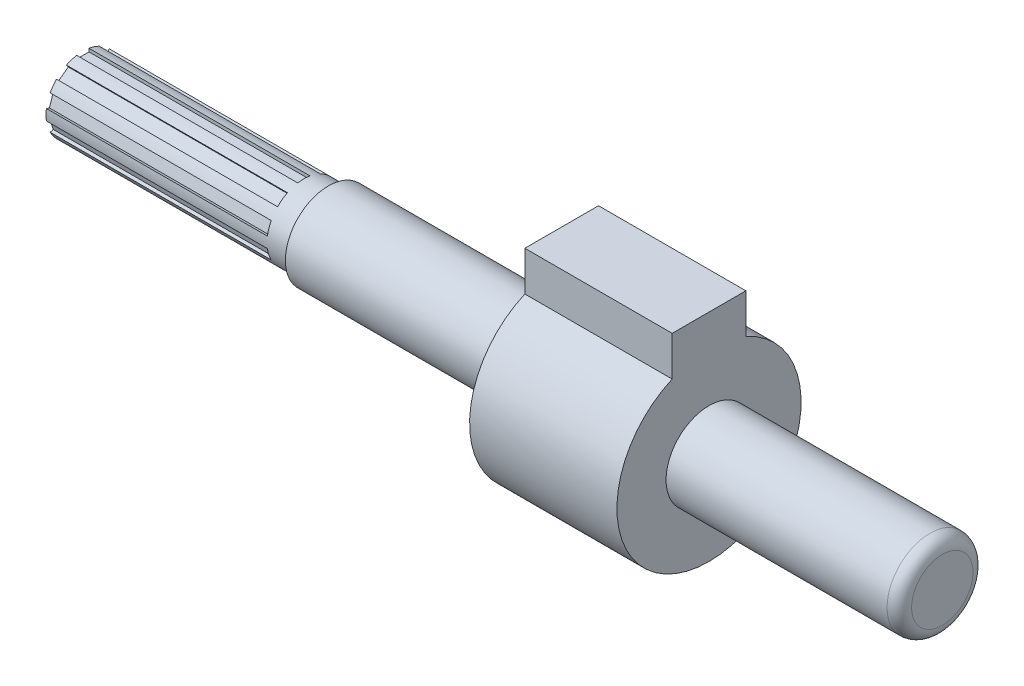
from build123d import *

# Parameters (mm, degrees)
Y_KSEKLIK_EKSTR_ZYON2_START = -12
Y_KSEKLIK_EKSTR_ZYON2_DEPTH = 12
KES_EKSTR_ZYON1_DEPTH       = 18
IZIM4_R                     = 3.5
IZIM4_R_2                   = 3
KES_EKSTR_ZYON2_DEPTH       = 20


with BuildPart() as part:
    # Çizim1 → Döndür1 (revolve)
    with BuildSketch(Plane.XY, mode=Mode.PRIVATE) as d_nd_r1_sk:
        with BuildLine():
            Line((0, 0), (70, 0))
            Line((70, 0), (70, 2.5))
            ThreePointArc((70, 2.5), (69.707106781, 3.207106781), (69, 3.5))
            Line((69, 3.5), (51, 3.5))
            Line((51, 3.5), (51, 7.5))
            Line((51, 7.5), (39, 7.5))
            Line((39, 7.5), (39, 3.5))
            Line((39, 3.5), (0, 3.5))
            Line((0, 3.5), (0, 0))
        make_face()
    revolve(d_nd_r1_sk.sketch.rotate(Axis((0, 0, 0), (1, 0, 0)), 90), axis=Axis((0, 0, 0), (1, 0, 0)))

    # Çizim2 → Yükseklik-Ekstrüzyon2 (add)
    with BuildSketch(Plane(origin=(51, 0, 0), x_dir=(0, 0, -1), z_dir=(1, 0, 0)).offset(Y_KSEKLIK_EKSTR_ZYON2_START)):
        with BuildLine():
            Line((-3, 10.1), (3, 10.1))
            Line((3, 10.1), (3, 6.873863542))
            ThreePointArc((3, 6.873863542), (0, 7.5), (-3, 6.873863542))
            Line((-3, 6.873863542), (-3, 10.1))
        make_face()
    extrude(amount=Y_KSEKLIK_EKSTR_ZYON2_DEPTH)

    # Çizim3 → Kes-Ekstrüzyon1 (cut)
    with BuildSketch(Plane.ZY):
        with BuildLine():
            Line((1.182511684, 2.478238511), (1.991528678, 1.890453259))
            Line((1.991528678, 1.890453259), (2.440656339, 2.508624451))
            ThreePointArc((2.440656339, 2.508624451), (2.057248383, 2.83155948), (1.631639345, 3.096409703))
            Line((1.631639345, 3.096409703), (1.182511684, 2.478238511))
        make_face()
        with BuildLine():
            Line((-0.5, 3.464101615), (-0.5, 2.7))
            Line((-0.5, 2.7), (0.5, 2.7))
            Line((0.5, 2.7), (0.5, 3.464101615))
            ThreePointArc((0.5, 3.464101615), (0, 3.5), (-0.5, 3.464101615))
        make_face()
        with BuildLine():
            Line((2.413344097, 1.309874143), (2.722361091, 0.358817627))
            Line((2.722361091, 0.358817627), (3.449064911, 0.594938011))
            ThreePointArc((3.449064911, 0.594938011), (3.328697807, 1.08155948), (3.140047917, 1.545994527))
            Line((3.140047917, 1.545994527), (2.413344097, 1.309874143))
        make_face()
        with BuildLine():
            Line((2.722361091, -0.358817627), (2.413344097, -1.309874143))
            Line((2.413344097, -1.309874143), (3.140047917, -1.545994527))
            ThreePointArc((3.140047917, -1.545994527), (3.328697807, -1.08155948), (3.449064911, -0.594938011))
            Line((3.449064911, -0.594938011), (2.722361091, -0.358817627))
        make_face()
        with BuildLine():
            Line((1.991528678, -1.890453259), (1.182511684, -2.478238511))
            Line((1.182511684, -2.478238511), (1.631639345, -3.096409703))
            ThreePointArc((1.631639345, -3.096409703), (2.057248383, -2.83155948), (2.440656339, -2.508624451))
            Line((2.440656339, -2.508624451), (1.991528678, -1.890453259))
        make_face()
        with BuildLine():
            Line((0.5, -2.7), (-0.5, -2.7))
            Line((-0.5, -2.7), (-0.5, -3.464101615))
            ThreePointArc((-0.5, -3.464101615), (0, -3.5), (0.5, -3.464101615))
            Line((0.5, -3.464101615), (0.5, -2.7))
        make_face()
        with BuildLine():
            Line((-1.182511684, -2.478238511), (-1.991528678, -1.890453259))
            Line((-1.991528678, -1.890453259), (-2.440656339, -2.508624451))
            ThreePointArc((-2.440656339, -2.508624451), (-2.057248383, -2.83155948), (-1.631639345, -3.096409703))
            Line((-1.631639345, -3.096409703), (-1.182511684, -2.478238511))
        make_face()
        with BuildLine():
            Line((-2.413344097, -1.309874143), (-2.722361091, -0.358817627))
            Line((-2.722361091, -0.358817627), (-3.449064911, -0.594938011))
            ThreePointArc((-3.449064911, -0.594938011), (-3.328697807, -1.08155948), (-3.140047917, -1.545994527))
            Line((-3.140047917, -1.545994527), (-2.413344097, -1.309874143))
        make_face()
        with BuildLine():
            Line((-2.722361091, 0.358817627), (-2.413344097, 1.309874143))
            Line((-2.413344097, 1.309874143), (-3.140047917, 1.545994527))
            ThreePointArc((-3.140047917, 1.545994527), (-3.328697807, 1.08155948), (-3.449064911, 0.594938011))
            Line((-3.449064911, 0.594938011), (-2.722361091, 0.358817627))
        make_face()
        with BuildLine():
            Line((-1.991528678, 1.890453259), (-1.182511684, 2.478238511))
            Line((-1.182511684, 2.478238511), (-1.631639345, 3.096409703))
            ThreePointArc((-1.631639345, 3.096409703), (-2.057248383, 2.83155948), (-2.440656339, 2.508624451))
            Line((-2.440656339, 2.508624451), (-1.991528678, 1.890453259))
        make_face()
    extrude(amount=-KES_EKSTR_ZYON1_DEPTH, mode=Mode.SUBTRACT)

    # Çizim4 → Kes-Ekstrüzyon2 (cut)
    with BuildSketch(Plane.ZY):
        Circle(IZIM4_R)
        Circle(IZIM4_R_2, mode=Mode.SUBTRACT)
    extrude(amount=-KES_EKSTR_ZYON2_DEPTH, mode=Mode.SUBTRACT)


solid = part.part
